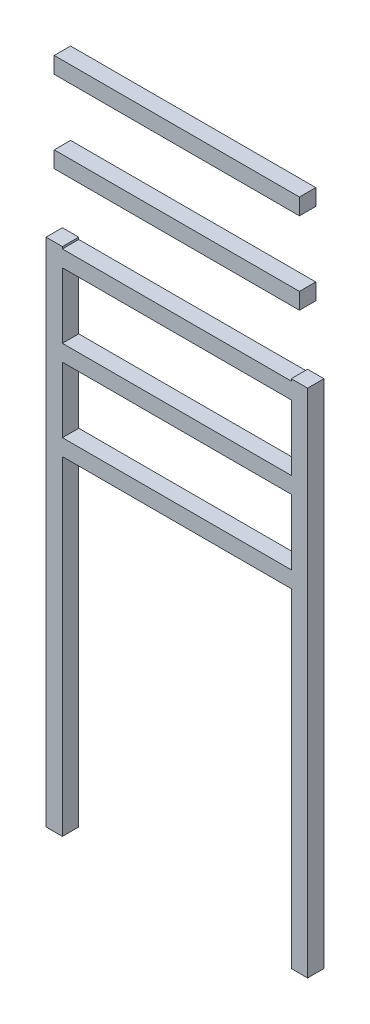
from build123d import *

# Parameters (mm, degrees)
SKETCH_1_W      = 80
SKETCH_1_H      = 2500
EXTRUDE_1_DEPTH = 80
SKETCH_2_W      = 80
SKETCH_2_H      = 2500
EXTRUDE_2_DEPTH = 80
SKETCH_3_W      = 1200
SKETCH_3_H      = 80
EXTRUDE_3_DEPTH = 80
SKETCH_4_W      = 1200
SKETCH_4_H      = 80
EXTRUDE_4_DEPTH = 80
SKETCH_5_W      = 1200
SKETCH_5_H      = 80
EXTRUDE_5_DEPTH = 80
SKETCH_6_W      = 1200
SKETCH_6_H      = 80
EXTRUDE_6_DEPTH = 80
SKETCH_7_W      = 1200
SKETCH_7_H      = 80
EXTRUDE_7_DEPTH = 80


with BuildPart() as part:
    # 草图1 → 凸台-拉伸1 (new body)
    with BuildSketch(Plane.XY):
        with Locations((-600, 0)):
            Rectangle(SKETCH_1_W, SKETCH_1_H)
    extrude(amount=EXTRUDE_1_DEPTH)



with BuildPart() as body_2:
    # 草图2 → 凸台-拉伸2 (new body)
    with BuildSketch(Plane.XY):
        with Locations((600, 0)):
            Rectangle(SKETCH_2_W, SKETCH_2_H)
    extrude(amount=EXTRUDE_2_DEPTH)


with BuildPart() as part_1:
    add(part.part)

    add(body_2.part)  # 凸台-拉伸3 merges body 2
    # 草图3 → 凸台-拉伸3 (add)
    with BuildSketch(Plane.XY):
        with Locations((0, 400)):
            Rectangle(SKETCH_3_W, SKETCH_3_H)
    extrude(amount=EXTRUDE_3_DEPTH)

    # 草图4 → 凸台-拉伸4 (add)
    with BuildSketch(Plane.XY):
        with Locations((0, 800)):
            Rectangle(SKETCH_4_W, SKETCH_4_H)
    extrude(amount=EXTRUDE_4_DEPTH)

    # 草图5 → 凸台-拉伸5 (add)
    with BuildSketch(Plane.XY):
        with Locations((0, 1200)):
            Rectangle(SKETCH_5_W, SKETCH_5_H)
    extrude(amount=EXTRUDE_5_DEPTH)


with BuildPart() as body_2_2:
    # 草图6 → 凸台-拉伸6 (new body)
    with BuildSketch(Plane.XY):
        with Locations((0, 1600)):
            Rectangle(SKETCH_6_W, SKETCH_6_H)
    extrude(amount=EXTRUDE_6_DEPTH)


with BuildPart() as body_3:
    # 草图7 → 凸台-拉伸7 (new body)
    with BuildSketch(Plane.XY):
        with Locations((0, 2000)):
            Rectangle(SKETCH_7_W, SKETCH_7_H)
    extrude(amount=EXTRUDE_7_DEPTH)


solid = Compound([part_1.part, body_2_2.part, body_3.part])
